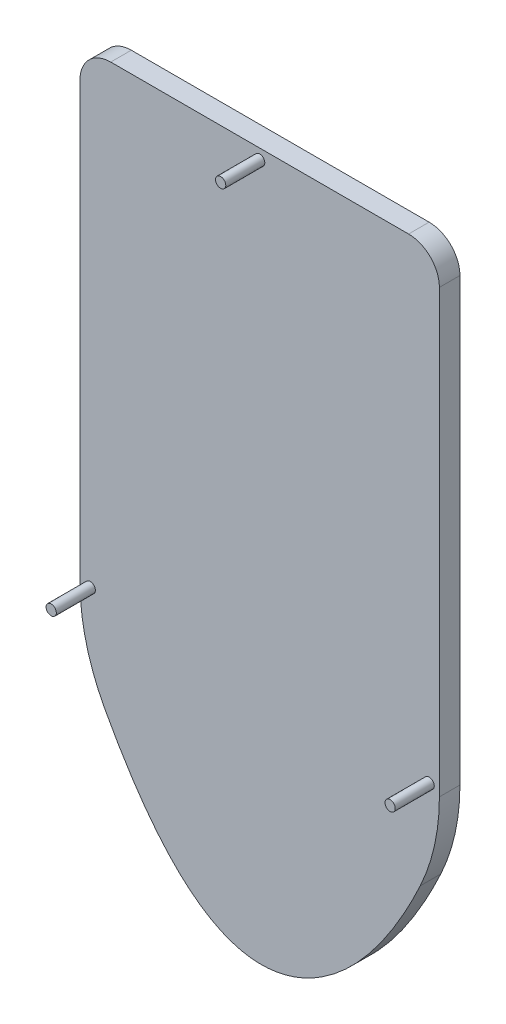
from build123d import *

# Parameters (mm, degrees)
BOSS_EXTRUDE1_DEPTH = 2
SKETCH2_W           = 0.5
SKETCH2_H           = 3.8
SKETCH3_W           = 0.5
SKETCH3_H           = 3.8
SKETCH4_W           = 0.5
SKETCH4_H           = 3.8
FILLET1_R           = 3
FILLET2_R           = 20


with BuildPart() as part:
    # Sketch1 → Boss-Extrude1 (new body)
    with BuildSketch(Plane.XY.offset(2)):
        with BuildLine():
            Line((7.771354167, 22.540832259), (-27.228645833, 22.540832259))
            Line((-27.228645833, 22.540832259), (-27.228645833, -27.813067392))
            add(Edge.make_bspline(
                [(-27.228645833, -27.813067392), (-26.427873486, -29.29582054), (-25.627101139, -30.778573688), (-24.826328792, -32.261326836), (-19.837606386, -41.498713565), (-9.897506481, -50.952288279), (1.392273584, -41.560087902), (5.904599103, -31.862127656), (6.526850791, -30.524774642), (7.149102479, -29.187421629), (7.771354167, -27.850068615)],
                knots=[0, 0, 0, 0, 0.06863763, 0.06863763, 0.06863763, 0.496242407, 0.937653653, 0.937653653, 0.937653653, 0.998524459, 0.998524459, 0.998524459, 0.998524459], degree=3))
            Line((7.771354167, -27.850068615), (7.771354167, 22.540832259))
        make_face()
    extrude(amount=-BOSS_EXTRUDE1_DEPTH)

    # Sketch2 → Revolve1 (revolve)
    with BuildSketch(Plane.XZ.offset(22.757561557), mode=Mode.PRIVATE) as revolve1_sk:
        with Locations((7.021354167, 3.9)):
            Rectangle(SKETCH2_W, SKETCH2_H)
    revolve(revolve1_sk.sketch.rotate(Axis((6.771354167, -22.757561557, 5.8), (0, 0, -1)), 180), axis=Axis((6.771354167, -22.757561557, 5.8), (0, 0, -1)))

    # Sketch3 → Revolve2 (revolve)
    with BuildSketch(Plane.XZ.offset(22.757561557), mode=Mode.PRIVATE) as revolve2_sk:
        with Locations((-25.978645833, 3.9)):
            Rectangle(SKETCH3_W, SKETCH3_H)
    revolve(revolve2_sk.sketch.rotate(Axis((-26.228645833, -22.757561557, 5.8), (0, 0, -1)), 180), axis=Axis((-26.228645833, -22.757561557, 5.8), (0, 0, -1)))

    # Sketch4 → Revolve3 (revolve)
    with BuildSketch(Plane.XZ.offset(-21.540832259), mode=Mode.PRIVATE) as revolve3_sk:
        with Locations((-9.478645833, 3.9)):
            Rectangle(SKETCH4_W, SKETCH4_H)
    revolve(revolve3_sk.sketch.rotate(Axis((-9.728645833, 21.540832259, 5.8), (0, 0, -1)), 180), axis=Axis((-9.728645833, 21.540832259, 5.8), (0, 0, -1)))

    # Fillet1
    fillet1_edges = [part.edges().sort_by_distance(p)[0] for p in [
        (-27.228645833, 22.540832259, 1),
        (7.771354167, 22.540832259, 1),
    ]]
    fillet(fillet1_edges, radius=FILLET1_R)

    # Fillet2
    fillet2_edges = [part.edges().sort_by_distance(p)[0] for p in [
        (7.771354167, -27.850068615, 1),
        (-27.228645833, -27.813067392, 1),
    ]]
    fillet(fillet2_edges, radius=FILLET2_R)


solid = part.part
